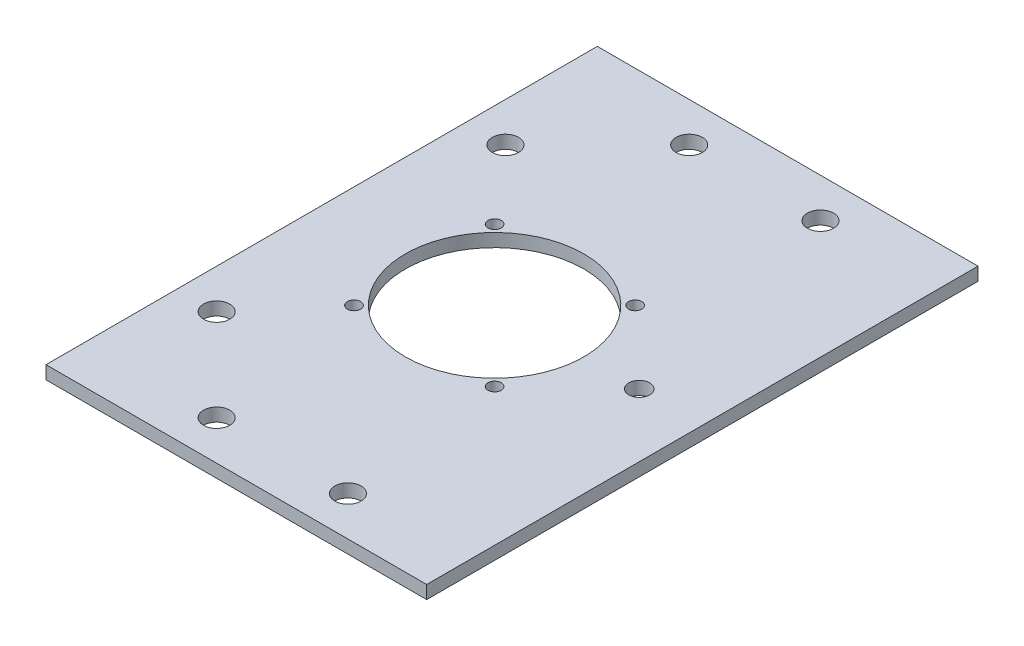
from build123d import *

# Parameters (mm, degrees)
SKETCH1_W           = 190.5
SKETCH1_H           = 133.35
BOSS_EXTRUDE1_DEPTH = 3.175
SKETCH3_R           = 21.59
CUT_EXTRUDE2_DEPTH  = 117.310785183
SKETCH4_R           = 1.6
SKETCH4_R_2         = 1.599999975
CUT_EXTRUDE3_DEPTH  = 3.175
SKETCH9_R           = 2.5273
CUT_EXTRUDE5_DEPTH  = 10
SKETCH12_W          = 98.425
SKETCH12_H          = 133.35
CUT_EXTRUDE6_DEPTH  = 117.310785183
SKETCH13_R          = 3.175
CUT_EXTRUDE7_DEPTH  = 117.310785183


with BuildPart() as part:
    # Sketch1 → Boss-Extrude1 (new body)
    with BuildSketch(Plane(origin=(0, 0, 0), x_dir=(1, 0, 0), z_dir=(0, 1, 0))):
        Rectangle(SKETCH1_W, SKETCH1_H)
    extrude(amount=BOSS_EXTRUDE1_DEPTH)

    # Sketch3 → Cut-Extrude2 (cut, through all)
    with BuildSketch(Plane(origin=(0, 3.175, 0), x_dir=(1, 0, 0), z_dir=(0, 1, 0))):
        with Locations(Location((-53.425, 0, 0), (0, 0, 270))):
            Circle(SKETCH3_R)
    extrude(amount=-CUT_EXTRUDE2_DEPTH, mode=Mode.SUBTRACT)

    # Sketch4 → Cut-Extrude3 (cut)
    with BuildSketch(Plane(origin=(0, 3.175, 0), x_dir=(1, 0, 0), z_dir=(0, 1, 0))):
        with Locations(Location((-70.425, 17, 0), (0, 0, 270))):
            Circle(SKETCH4_R)
        with Locations(Location((-36.425, 17, 0), (0, 0, 270))):
            Circle(SKETCH4_R_2)
        with Locations(Location((-70.425, -17, 0), (0, 0, 270))):
            Circle(SKETCH4_R)
        with Locations(Location((-36.425, -17, 0), (0, 0, 270))):
            Circle(SKETCH4_R)
    extrude(amount=-CUT_EXTRUDE3_DEPTH, mode=Mode.SUBTRACT)

    # Sketch9 → Cut-Extrude5 (cut)
    with BuildSketch(Plane(origin=(0, 3.175, 0), x_dir=(1, 0, 0), z_dir=(0, 1, 0))):
        with Locations(Location((-18.4365, 0, 0), (0, 0, 270))):
            Circle(SKETCH9_R)
    extrude(amount=-CUT_EXTRUDE5_DEPTH, mode=Mode.SUBTRACT)

    # Sketch12 → Cut-Extrude6 (cut, through all)
    with BuildSketch(Plane(origin=(0, 3.175, 0), x_dir=(1, 0, 0), z_dir=(0, 1, 0))):
        with Locations((46.0375, 0)):
            Rectangle(SKETCH12_W, SKETCH12_H)
    extrude(amount=-CUT_EXTRUDE6_DEPTH, mode=Mode.SUBTRACT)

    # Sketch13 → Cut-Extrude7 (cut, through all)
    with BuildSketch(Plane(origin=(0, 3.175, 0), x_dir=(1, 0, 0), z_dir=(0, 1, 0))):
        with Locations(Location((-63.5, -57.15, 0), (0, 0, 270))):
            Circle(SKETCH13_R)
        with Locations(Location((-31.75, -57.15, 0), (0, 0, 270))):
            Circle(SKETCH13_R)
        with Locations(Location((-85.725, -34.925, 0), (0, 0, 270))):
            Circle(SKETCH13_R)
        with Locations(Location((-85.725, 34.925, 0), (0, 0, 90))):
            Circle(SKETCH13_R)
        with Locations(Location((-31.75, 57.15, 0), (0, 0, 90))):
            Circle(SKETCH13_R)
        with Locations(Location((-63.5, 57.15, 0), (0, 0, 90))):
            Circle(SKETCH13_R)
    extrude(amount=-CUT_EXTRUDE7_DEPTH, mode=Mode.SUBTRACT)


solid = part.part
